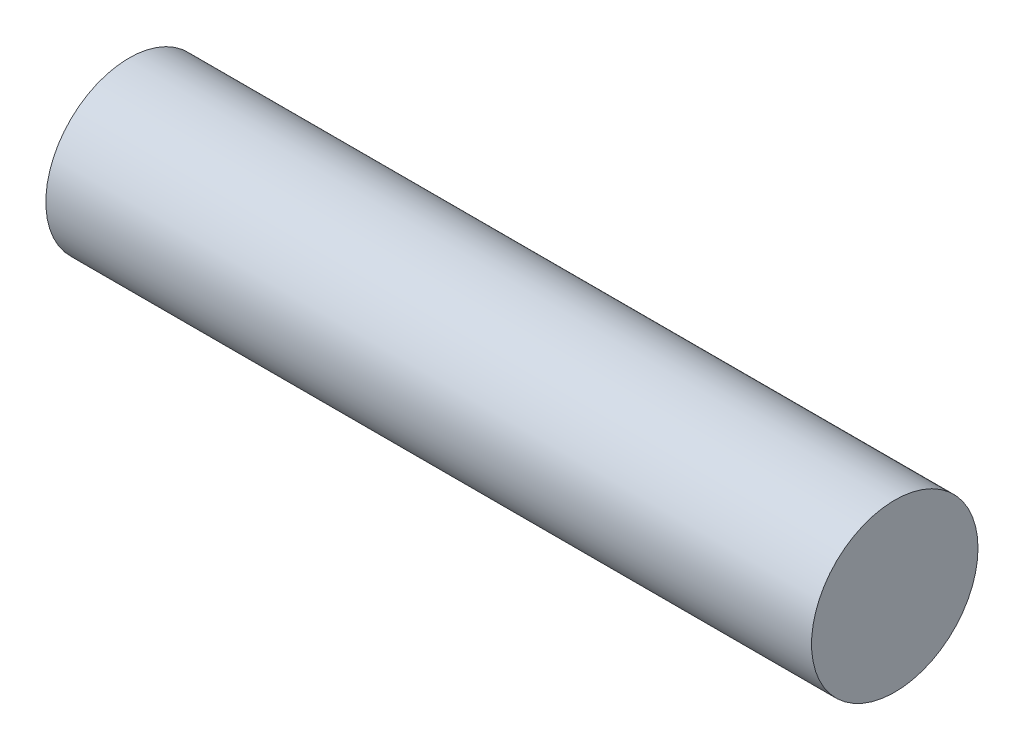
from build123d import *

# Parameters (mm, degrees)
PROFILE_SKETCH_R      = 5
PROFILE_EXTRUDE_DEPTH = 46


with BuildPart() as part:
    # Profile Sketch → Profile Extrude (new body)
    with BuildSketch(Plane(origin=(0, 0, 0), x_dir=(0, 0, -1), z_dir=(1, 0, 0))):
        Circle(PROFILE_SKETCH_R)
    extrude(amount=PROFILE_EXTRUDE_DEPTH)


solid = part.part
